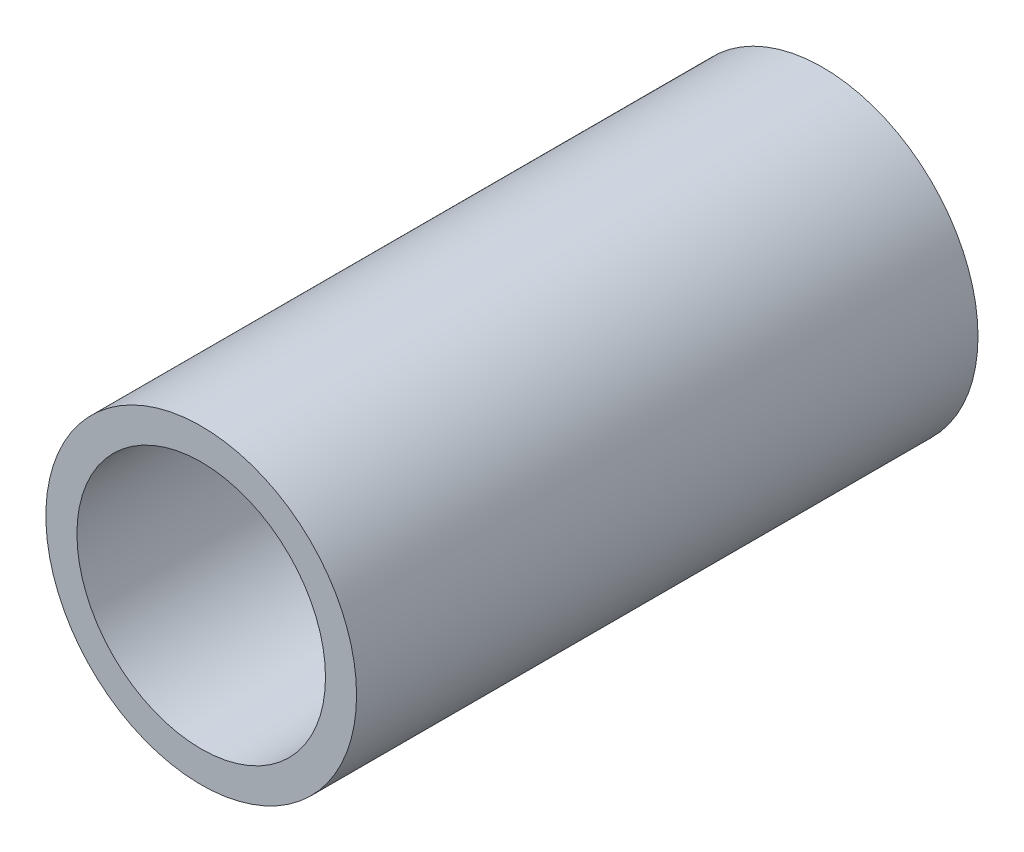
from build123d import *

# Parameters (mm, degrees)
CROQUIS1_R              = 10
CROQUIS1_R_2            = 8
SALIENTE_EXTRUIR1_DEPTH = 40


with BuildPart() as part:
    # Croquis1 → Saliente-Extruir1 (new body)
    with BuildSketch(Plane.XY):
        Circle(CROQUIS1_R)
        Circle(CROQUIS1_R_2, mode=Mode.SUBTRACT)
    extrude(amount=SALIENTE_EXTRUIR1_DEPTH)


solid = part.part
